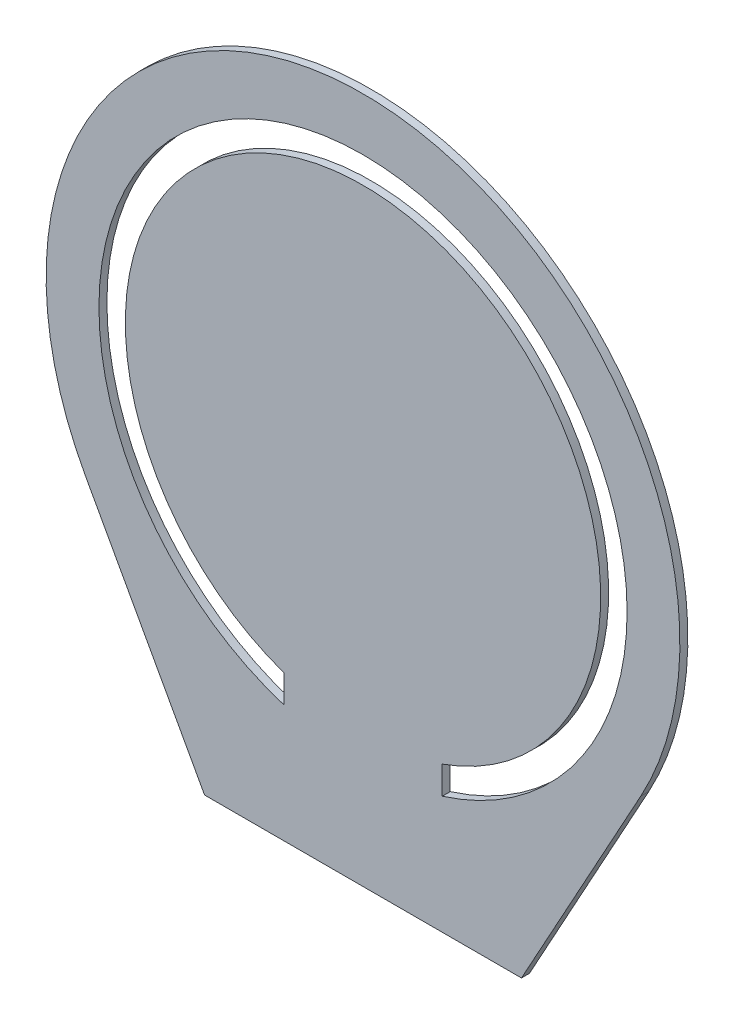
from build123d import *

# Parameters (mm, degrees)
BOSS_EXTRUDE1_DEPTH = 0.75438


with BuildPart() as part:
    # Sketch1 → Boss-Extrude1 (new body)
    with BuildSketch(Plane.XY):
        with BuildLine():
            Line((-15, -35), (15, -35))
            Line((15, -35), (26.292884648, -14.44590658))
            ThreePointArc((26.292884648, -14.44590658), (0, 30), (-26.292884648, -14.44590658))
            Line((-26.292884648, -14.44590658), (-15, -35))
        make_face()
        with BuildLine():
            Line((-7.5, -23.848480035), (-7.5, -21.213203436))
            ThreePointArc((-7.5, -21.213203436), (0, 22.5), (7.5, -21.213203436))
            Line((7.5, -21.213203436), (7.5, -23.848480035))
            ThreePointArc((7.5, -23.848480035), (0, 25), (-7.5, -23.848480035))
        make_face(mode=Mode.SUBTRACT)
    extrude(amount=BOSS_EXTRUDE1_DEPTH)


solid = part.part
